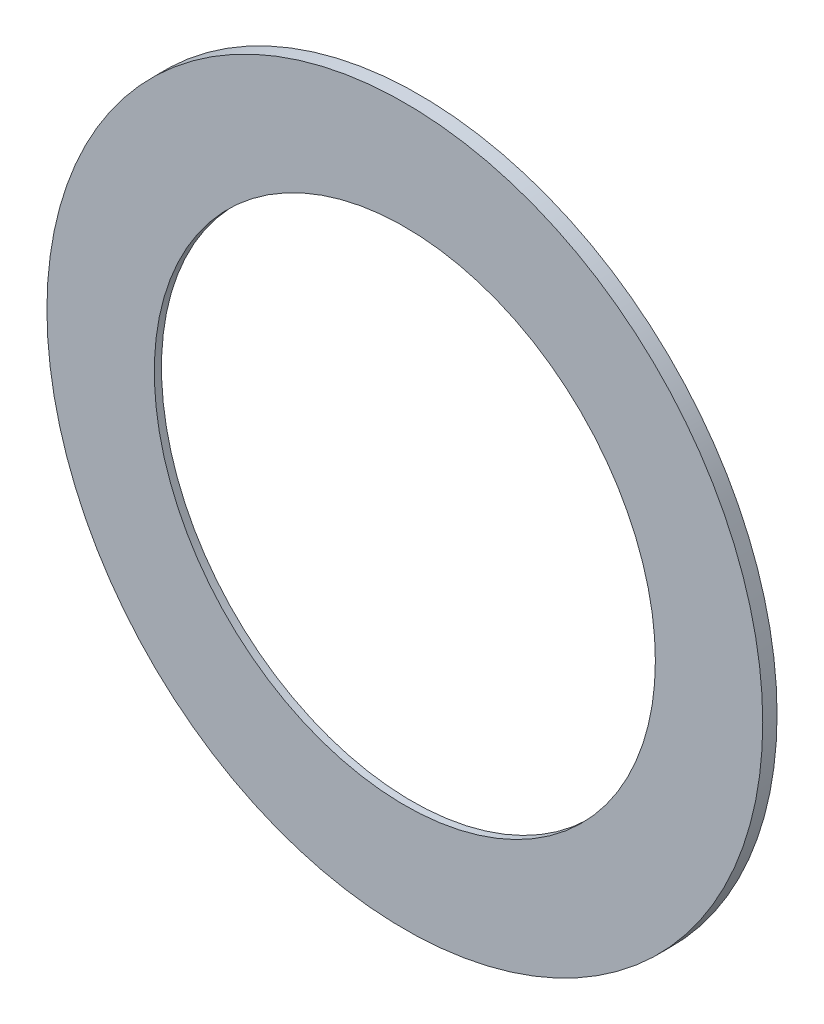
from build123d import *

# Parameters (mm, degrees)
CROQUIS1_R              = 200
CROQUIS1_R_2            = 160
CROQUIS1_R_3            = 5.4
SALIENTE_EXTRUIR1_DEPTH = 4
CROQUIS2_R              = 200
CROQUIS2_R_2            = 140
SALIENTE_EXTRUIR2_DEPTH = 4


with BuildPart() as part:
    # Croquis1 → Saliente-Extruir1 (new body)
    with BuildSketch(Plane.XY):
        Circle(CROQUIS1_R)
        Circle(CROQUIS1_R_2, mode=Mode.SUBTRACT)
        with Locations((145.623058987, 105.801345413)):
            Circle(CROQUIS1_R_3, mode=Mode.SUBTRACT)
        with Locations((164.438182376, 73.212595754)):
            Circle(CROQUIS1_R_3, mode=Mode.SUBTRACT)
        with Locations((176.066568132, 37.424104347)):
            Circle(CROQUIS1_R_3, mode=Mode.SUBTRACT)
        with Locations((180, 0)):
            Circle(CROQUIS1_R_3, mode=Mode.SUBTRACT)
        with Locations((176.066568132, -37.424104347)):
            Circle(CROQUIS1_R_3, mode=Mode.SUBTRACT)
        with Locations((164.438182376, -73.212595754)):
            Circle(CROQUIS1_R_3, mode=Mode.SUBTRACT)
        with Locations((145.623058987, -105.801345413)):
            Circle(CROQUIS1_R_3, mode=Mode.SUBTRACT)
        with Locations((120.443509145, -133.766068586)):
            Circle(CROQUIS1_R_3, mode=Mode.SUBTRACT)
        with Locations((90, -155.884572681)):
            Circle(CROQUIS1_R_3, mode=Mode.SUBTRACT)
        with Locations((55.623058987, -171.190172933)):
            Circle(CROQUIS1_R_3, mode=Mode.SUBTRACT)
        with Locations((18.815123388, -179.013941166)):
            Circle(CROQUIS1_R_3, mode=Mode.SUBTRACT)
        with Locations((-18.815123388, -179.013941166)):
            Circle(CROQUIS1_R_3, mode=Mode.SUBTRACT)
        with Locations((-55.623058987, -171.190172933)):
            Circle(CROQUIS1_R_3, mode=Mode.SUBTRACT)
        with Locations((-90, -155.884572681)):
            Circle(CROQUIS1_R_3, mode=Mode.SUBTRACT)
        with Locations((-120.443509145, -133.766068586)):
            Circle(CROQUIS1_R_3, mode=Mode.SUBTRACT)
        with Locations((-145.623058987, -105.801345413)):
            Circle(CROQUIS1_R_3, mode=Mode.SUBTRACT)
        with Locations((-164.438182376, -73.212595754)):
            Circle(CROQUIS1_R_3, mode=Mode.SUBTRACT)
        with Locations((-176.066568132, -37.424104347)):
            Circle(CROQUIS1_R_3, mode=Mode.SUBTRACT)
        with Locations((-180, 0)):
            Circle(CROQUIS1_R_3, mode=Mode.SUBTRACT)
        with Locations((-176.066568132, 37.424104347)):
            Circle(CROQUIS1_R_3, mode=Mode.SUBTRACT)
        with Locations((-164.438182376, 73.212595754)):
            Circle(CROQUIS1_R_3, mode=Mode.SUBTRACT)
        with Locations((-145.623058987, 105.801345413)):
            Circle(CROQUIS1_R_3, mode=Mode.SUBTRACT)
        with Locations((-120.443509145, 133.766068586)):
            Circle(CROQUIS1_R_3, mode=Mode.SUBTRACT)
        with Locations((-90, 155.884572681)):
            Circle(CROQUIS1_R_3, mode=Mode.SUBTRACT)
        with Locations((-55.623058987, 171.190172933)):
            Circle(CROQUIS1_R_3, mode=Mode.SUBTRACT)
        with Locations((-18.815123388, 179.013941166)):
            Circle(CROQUIS1_R_3, mode=Mode.SUBTRACT)
        with Locations((18.815123388, 179.013941166)):
            Circle(CROQUIS1_R_3, mode=Mode.SUBTRACT)
        with Locations((55.623058987, 171.190172933)):
            Circle(CROQUIS1_R_3, mode=Mode.SUBTRACT)
        with Locations((90, 155.884572681)):
            Circle(CROQUIS1_R_3, mode=Mode.SUBTRACT)
        with Locations((120.443509145, 133.766068586)):
            Circle(CROQUIS1_R_3, mode=Mode.SUBTRACT)
    extrude(amount=SALIENTE_EXTRUIR1_DEPTH)

    # Croquis2 → Saliente-Extruir2 (add)
    with BuildSketch(Plane.XY.offset(4)):
        Circle(CROQUIS2_R)
        Circle(CROQUIS2_R_2, mode=Mode.SUBTRACT)
    extrude(amount=SALIENTE_EXTRUIR2_DEPTH)


solid = part.part
